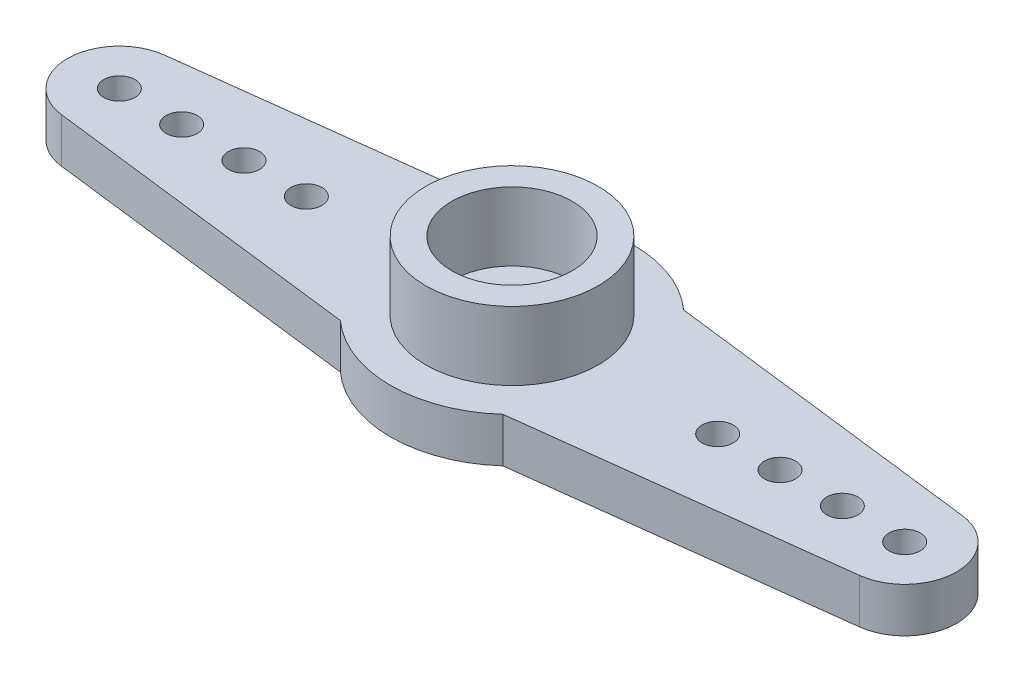
from build123d import *

# Parameters (mm, degrees)
SKETCH1_R           = 5.85
SKETCH1_R_2         = 1.25
SKETCH1_R_3         = 0.75
BOSS_EXTRUDE1_DEPTH = 2.15
SKETCH2_R           = 4.15
SKETCH2_R_2         = 2.9
BOSS_EXTRUDE2_DEPTH = 3.3


with BuildPart() as part:
    # Sketch1 → Boss-Extrude1 (new body)
    # profile 1 of 3: a face of its own
    with BuildSketch(Plane(origin=(0, 0, 0), x_dir=(1, 0, 0), z_dir=(0, 1, 0))):
        Circle(SKETCH1_R)
        with Locations(Location((0, 0, 0), (0, 0, 90))):
            Circle(SKETCH1_R_2, mode=Mode.SUBTRACT)
    # profile 2 of 3: a face of its own
    with BuildSketch(Plane(origin=(0, 0, 0), x_dir=(1, 0, 0), z_dir=(0, 1, 0))):
        with BuildLine():
            Line((-3.911521443, 4.35), (-19.203214028, 2.481544127))
            ThreePointArc((-19.203214028, 2.481544127), (-21.4, 0), (-19.203214028, -2.481544127))
            Line((-19.203214028, -2.481544127), (-3.911521443, -4.35))
            ThreePointArc((-3.911521443, -4.35), (-5.85, 0), (-3.911521443, 4.35))
        make_face()
        with Locations(Location((-18.9, 0, 0), (0, 0, 90))):
            Circle(SKETCH1_R_3, mode=Mode.SUBTRACT)
        with Locations(Location((-15.9, 0, 0), (0, 0, 90))):
            Circle(SKETCH1_R_3, mode=Mode.SUBTRACT)
        with Locations(Location((-12.9, 0, 0), (0, 0, 90))):
            Circle(SKETCH1_R_3, mode=Mode.SUBTRACT)
        with Locations(Location((-9.9, 0, 0), (0, 0, 90))):
            Circle(SKETCH1_R_3, mode=Mode.SUBTRACT)
    # profile 3 of 3: a face of its own
    with BuildSketch(Plane(origin=(0, 0, 0), x_dir=(1, 0, 0), z_dir=(0, 1, 0))):
        with BuildLine():
            Line((19.203214028, 2.481544127), (3.911521443, 4.35))
            ThreePointArc((3.911521443, 4.35), (5.343449281, 2.381186633), (5.85, 0))
            ThreePointArc((5.85, 0), (5.343449281, -2.381186633), (3.911521443, -4.35))
            Line((3.911521443, -4.35), (19.203214028, -2.481544127))
            ThreePointArc((19.203214028, -2.481544127), (21.4, 0), (19.203214028, 2.481544127))
        make_face()
        with Locations(Location((9.9, 0, 0), (0, 0, 90))):
            Circle(SKETCH1_R_3, mode=Mode.SUBTRACT)
        with Locations(Location((12.9, 0, 0), (0, 0, 90))):
            Circle(SKETCH1_R_3, mode=Mode.SUBTRACT)
        with Locations(Location((15.9, 0, 0), (0, 0, 90))):
            Circle(SKETCH1_R_3, mode=Mode.SUBTRACT)
        with Locations(Location((18.9, 0, 0), (0, 0, 90))):
            Circle(SKETCH1_R_3, mode=Mode.SUBTRACT)
    extrude(amount=BOSS_EXTRUDE1_DEPTH)

    # Sketch2 → Boss-Extrude2 (add)
    with BuildSketch(Plane(origin=(0, 2.15, 0), x_dir=(1, 0, 0), z_dir=(0, 1, 0))):
        with Locations(Location((0, 0, 0), (0, 0, 270))):
            Circle(SKETCH2_R)
        with Locations(Location((0, 0, 0), (0, 0, 270))):
            Circle(SKETCH2_R_2, mode=Mode.SUBTRACT)
    extrude(amount=BOSS_EXTRUDE2_DEPTH)


solid = part.part
